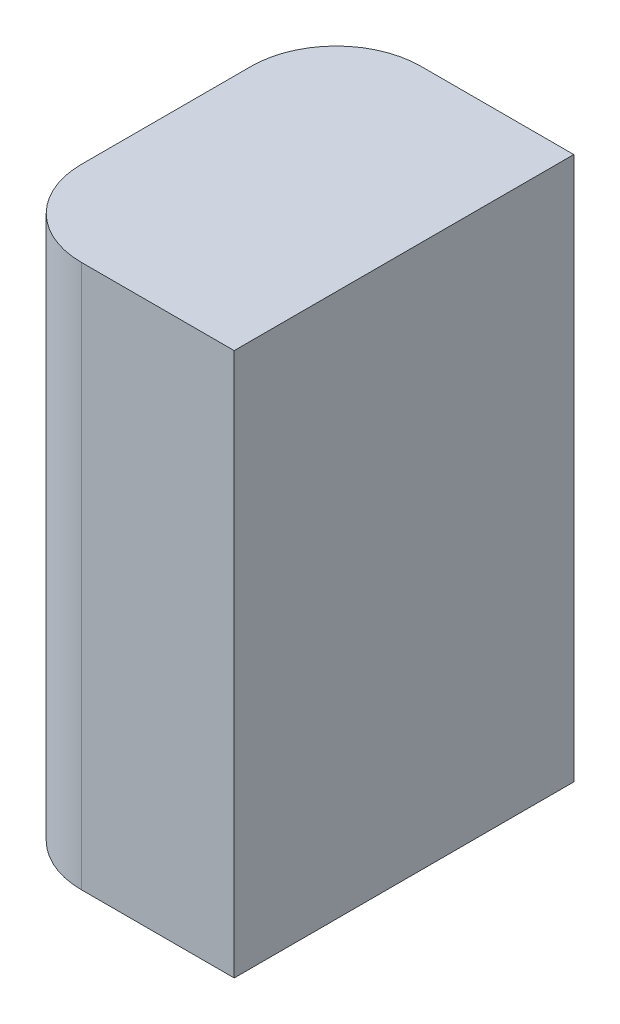
from build123d import *

# Parameters (mm, degrees)
BOSS_EXTRUDE1_DEPTH = 203.2


with BuildPart() as part:
    # Sketch1 → Boss-Extrude1 (new body)
    with BuildSketch(Plane(origin=(0, 0, 0), x_dir=(1, 0, 0), z_dir=(0, 1, 0))):
        with BuildLine():
            Line((31.75, 0), (88.9, 0))
            Line((88.9, 0), (88.9, 127))
            Line((88.9, 127), (31.75, 127))
            ThreePointArc((31.75, 127), (9.299359697, 117.700640303), (0, 95.25))
            Line((0, 95.25), (0, 31.75))
            ThreePointArc((0, 31.75), (9.299359697, 9.299359697), (31.75, 0))
        make_face()
    extrude(amount=BOSS_EXTRUDE1_DEPTH)


solid = part.part
